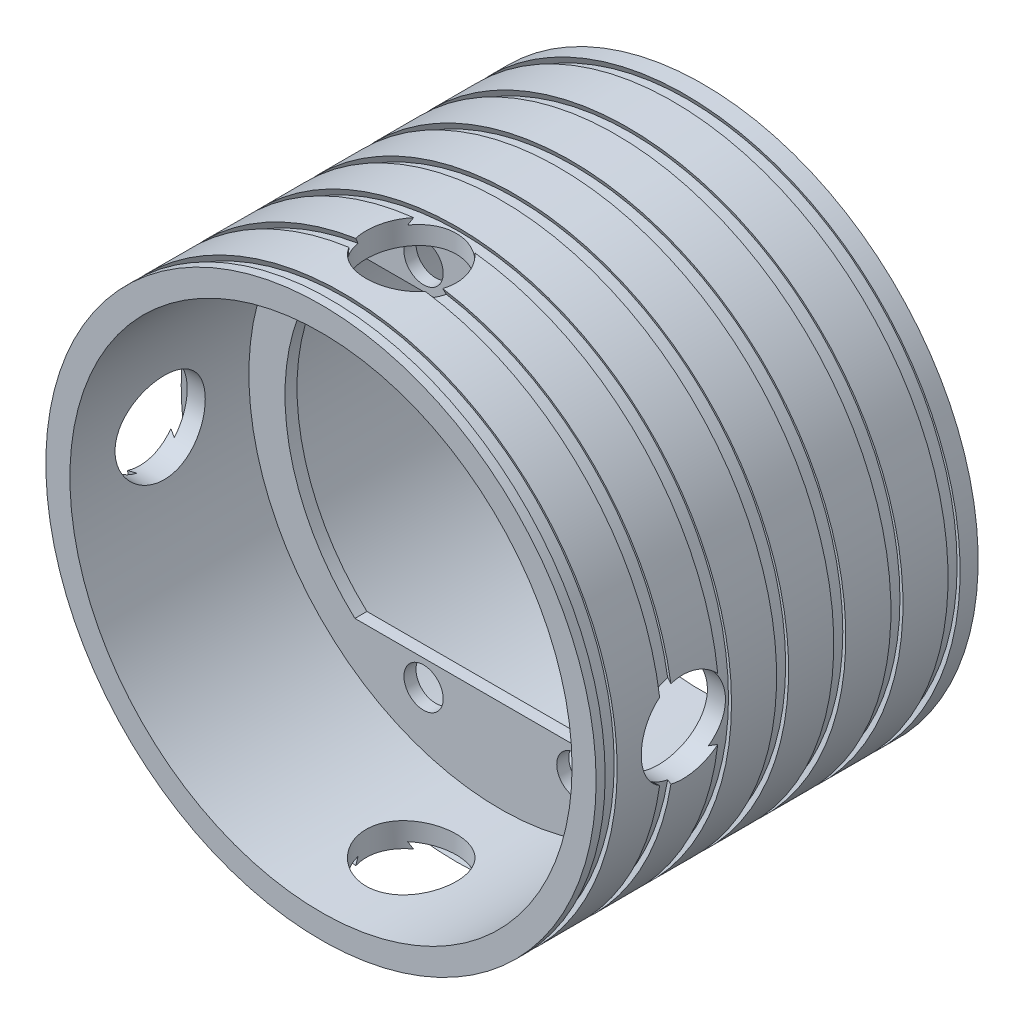
from build123d import *

# Parameters (mm, degrees)
SKETCH1_R               = 45.734416477
SKETCH1_R_2             = 41.734416477
BOSS_EXTRUDE1_DEPTH     = 31.75
BOSS_EXTRUDE2_START     = 2
SKETCH1_3_R             = 41.734416477
SKETCH1_3_R_2           = 35.734416477
BOSS_EXTRUDE2_DEPTH     = 2
BOSS_EXTRUDE3_START     = 31.75
SKETCH1_4_R             = 45.734416477
SKETCH1_4_R_2           = 41.734416477
BOSS_EXTRUDE3_DEPTH     = 31.75
CUT_EXTRUDE1_DEPTH      = 73.050927828
CUT_EXTRUDE1_DEPTH_BACK = 73.050927828
SKETCH7_R               = 7.5
CUT_EXTRUDE2_DEPTH      = 73.050927999
CUT_EXTRUDE2_DEPTH_BACK = 73.050927999
SKETCH8_R               = 7.5
F_1_4_CLEARANCE_HOLE1_D = 6.5278
FILLET1_R               = 1


with BuildPart() as part:
    # Sketch1 → Boss-Extrude1 (new body)
    with BuildSketch(Plane.XY):
        Circle(SKETCH1_R)
        Circle(SKETCH1_R_2, mode=Mode.SUBTRACT)
    extrude(amount=-BOSS_EXTRUDE1_DEPTH)



with BuildPart() as body_2:
    # Sketch1<3> → Boss-Extrude2 (new body)
    # profile 1 of 3: a face of its own
    with BuildSketch(Plane.XY.offset(BOSS_EXTRUDE2_START)):
        Circle(SKETCH1_3_R)
        Circle(SKETCH1_3_R_2, mode=Mode.SUBTRACT)
    # profile 2 of 3: a face of its own
    with BuildSketch(Plane.XY.offset(BOSS_EXTRUDE2_START)):
        with BuildLine():
            ThreePointArc((24.113146123, 26.372423192), (0, 35.734416477), (-24.113146123, 26.372423192))
            Line((-24.113146123, 26.372423192), (24.113146123, 26.372423192))
        make_face()
    # profile 3 of 3: a face of its own
    with BuildSketch(Plane.XY.offset(BOSS_EXTRUDE2_START)):
        with BuildLine():
            ThreePointArc((-24.113146123, -26.372423192), (0, -35.734416477), (24.113146123, -26.372423192))
            Line((24.113146123, -26.372423192), (-24.113146123, -26.372423192))
        make_face()
    extrude(amount=-BOSS_EXTRUDE2_DEPTH)


with BuildPart() as part_1:
    add(part.part)

    add(body_2.part)  # Boss-Extrude3 merges body 2
    # Sketch1<4> → Boss-Extrude3 (add)
    with BuildSketch(Plane.XY.offset(BOSS_EXTRUDE3_START)):
        Circle(SKETCH1_4_R)
        Circle(SKETCH1_4_R_2, mode=Mode.SUBTRACT)
    extrude(amount=-BOSS_EXTRUDE3_DEPTH)

    # Sketch2 → Cut-Revolve1 (revolve, cut)
    with BuildSketch(Plane(origin=(0, 0, 0), x_dir=(0, 0, -1), z_dir=(1, 0, 0)), mode=Mode.PRIVATE) as cut_revolve1_sk:
        Polygon((-18.25, 44.734416477), (-21.25, 44.734416477), (-20.75, 45.734416477), (-18.75, 45.734416477), align=None)
        Polygon((-27.75, 44.734416477), (-30.75, 44.734416477), (-30.25, 45.734416477), (-28.25, 45.734416477), align=None)
        Polygon((-8.75, 44.734416477), (-11.75, 44.734416477), (-11.25, 45.734416477), (-9.25, 45.734416477), align=None)
        Polygon((0.75, 44.734416477), (-2.25, 44.734416477), (-1.75, 45.734416477), (0.25, 45.734416477), align=None)
        Polygon((10.25, 44.734416477), (7.25, 44.734416477), (7.75, 45.734416477), (9.75, 45.734416477), align=None)
        Polygon((19.75, 44.734416477), (16.75, 44.734416477), (17.25, 45.734416477), (19.25, 45.734416477), align=None)
        Polygon((29.25, 44.734416477), (26.25, 44.734416477), (26.75, 45.734416477), (28.75, 45.734416477), align=None)
    revolve(cut_revolve1_sk.sketch.rotate(Axis((0, 0, 2), (0, 0, 1)), 90), axis=Axis((0, 0, 2), (0, 0, 1)), mode=Mode.SUBTRACT)

    # Sketch7 → Cut-Extrude1 (cut, two sides: drawn at the far end of the back side and taken through both)
    with BuildSketch(Plane(origin=(0, 0, 0), x_dir=(0, 0, -1), z_dir=(1, 0, 0)).offset(-CUT_EXTRUDE1_DEPTH_BACK)):
        with Locations((-16.75, 0)):
            Circle(SKETCH7_R)
    extrude(amount=CUT_EXTRUDE1_DEPTH + CUT_EXTRUDE1_DEPTH_BACK, mode=Mode.SUBTRACT)

    # Sketch8 → Cut-Extrude2 (cut, two sides: drawn at the far end of the back side and taken through both)
    with BuildSketch(Plane(origin=(0, 0, 0), x_dir=(1, 0, 0), z_dir=(0, 1, 0)).offset(-CUT_EXTRUDE2_DEPTH_BACK)):
        with Locations(Location((0, -16.75, 0), (0, 0, 270))):
            Circle(SKETCH8_R)
    extrude(amount=CUT_EXTRUDE2_DEPTH + CUT_EXTRUDE2_DEPTH_BACK, mode=Mode.SUBTRACT)

    # 1/4 Clearance Hole1 (through all)
    with Locations(Plane(origin=(-9.400590757, -2.512492172, 0), x_dir=(-1, 0, 0), z_dir=(0, 0, -1))):
        with Locations((3.299409243, 33.134408648), (-22.100590757, 33.134408648), (-22.100590757, -28.109424305), (3.299409243, -28.109424305)):
            Hole(F_1_4_CLEARANCE_HOLE1_D / 2)

    # Fillet1
    fillet1_edges = [part_1.edges().sort_by_distance(p)[0] for p in [
        (-41.734416477, 0, 0),
    ]]
    fillet(fillet1_edges, radius=FILLET1_R)


solid = part_1.part
